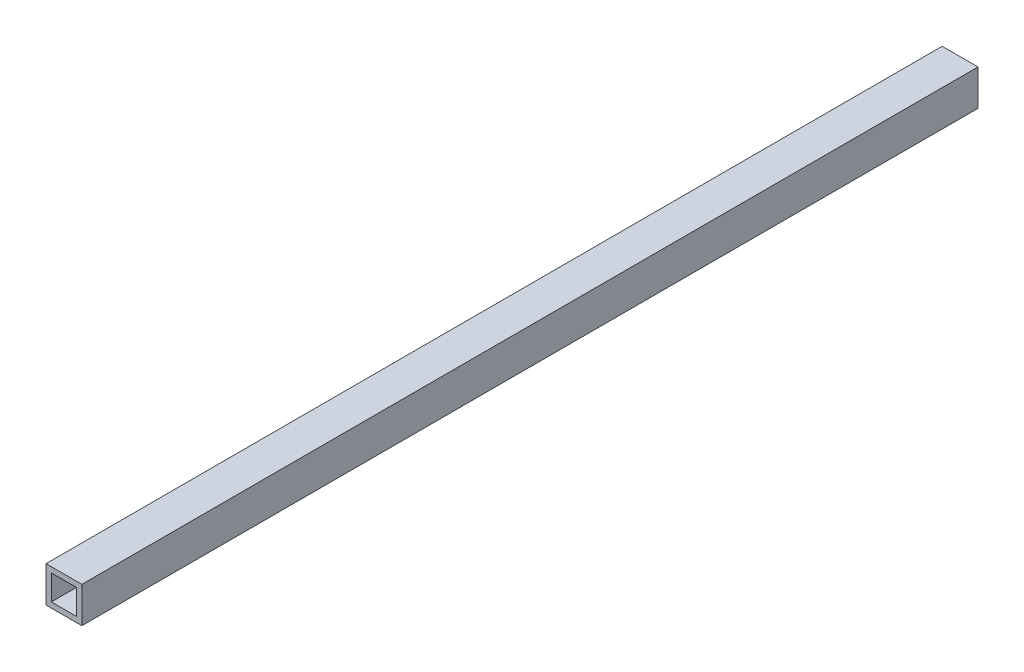
from build123d import *

# Parameters (mm, degrees)
SKETCH_1_W      = 10
SKETCH_1_H      = 10
SKETCH_1_W_2    = 7
SKETCH_1_H_2    = 7
EXTRUDE_1_DEPTH = 250


with BuildPart() as part:
    # 草图1 → 凸台-拉伸1 (new body)
    with BuildSketch(Plane.XY):
        Rectangle(SKETCH_1_W, SKETCH_1_H)
        Rectangle(SKETCH_1_W_2, SKETCH_1_H_2, mode=Mode.SUBTRACT)
    extrude(amount=EXTRUDE_1_DEPTH)


solid = part.part
